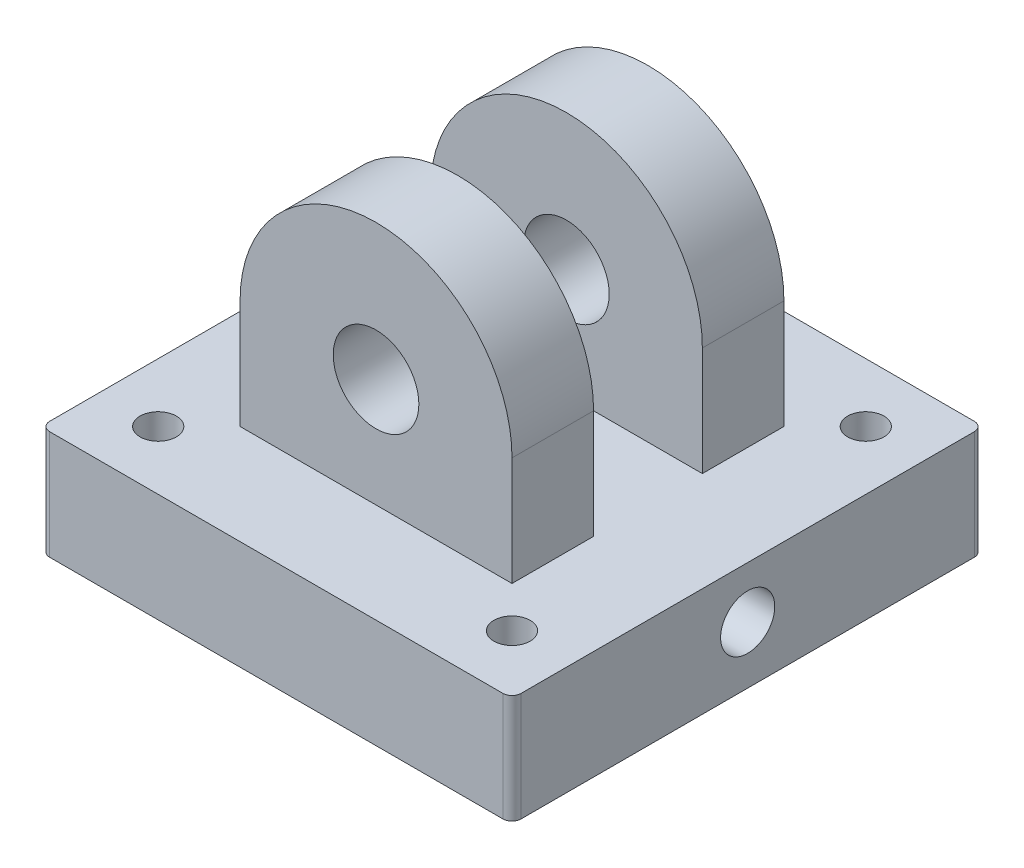
from build123d import *

# Parameters (mm, degrees)
SKETCH1_R                         = 6.35
BOSS_EXTRUDE1_DEPTH               = 38.1
BOSS_EXTRUDE2_START               = -34.925
SKETCH2_R                         = 15
BOSS_EXTRUDE2_DEPTH               = 28.575
SKETCH3_R                         = 26
CUT_EXTRUDE1_DEPTH                = 36.83
SKETCH4_R                         = 76.2
SKETCH4_R_2                       = 69.85
CUT_EXTRUDE2_DEPTH                = 8
F_1_2_14_NPSM_TAPPED_HOLE1_REACH  = 224.273
F_1_2_14_NPSM_TAPPED_HOLE1_BORE_R = 9.4869


with BuildPart() as part:
    # Sketch1 → Boss-Extrude1 (new body)
    with BuildSketch(Plane(origin=(0, 0, 0), x_dir=(1, 0, 0), z_dir=(0, 1, 0))):
        with BuildLine():
            Line((-79.375, -82.55), (79.375, -82.55))
            ThreePointArc((79.375, -82.55), (81.62006403, -81.62006403), (82.55, -79.375))
            Line((82.55, -79.375), (82.55, 79.375))
            ThreePointArc((82.55, 79.375), (81.62006403, 81.62006403), (79.375, 82.55))
            Line((79.375, 82.55), (-79.375, 82.55))
            ThreePointArc((-79.375, 82.55), (-81.62006403, 81.62006403), (-82.55, 79.375))
            Line((-82.55, 79.375), (-82.55, -79.375))
            ThreePointArc((-82.55, -79.375), (-81.62006403, -81.62006403), (-79.375, -82.55))
        make_face()
        with Locations(Location((61.963767235, 61.963767235, 0), (0, 0, 90))):
            Circle(SKETCH1_R, mode=Mode.SUBTRACT)
        with Locations(Location((61.963767235, -61.963767235, 0), (0, 0, 90))):
            Circle(SKETCH1_R, mode=Mode.SUBTRACT)
        with Locations(Location((-61.963767235, -61.963767235, 0), (0, 0, 90))):
            Circle(SKETCH1_R, mode=Mode.SUBTRACT)
        with Locations(Location((-61.963767235, 61.963767235, 0), (0, 0, 90))):
            Circle(SKETCH1_R, mode=Mode.SUBTRACT)
    extrude(amount=BOSS_EXTRUDE1_DEPTH)

    # Sketch2 → Boss-Extrude2 (add)
    with BuildSketch(Plane.XY.offset(82.55).offset(BOSS_EXTRUDE2_START)):
        with BuildLine():
            Line((-47.625, 38.1), (-47.625, 76.2))
            ThreePointArc((-47.625, 76.2), (0, 123.825), (47.625, 76.2))
            Line((47.625, 76.2), (47.625, 38.1))
            Line((47.625, 38.1), (-47.625, 38.1))
        make_face()
        with Locations((0, 76.2)):
            Circle(SKETCH2_R, mode=Mode.SUBTRACT)
    boss_extrude2 = extrude(amount=-BOSS_EXTRUDE2_DEPTH)

    # Mirror1: Boss-Extrude2 across plane
    add(boss_extrude2.mirror(Plane.XY))

    # Sketch3 → Cut-Extrude1 (cut)
    with BuildSketch(Plane.XZ):
        with Locations(Location((0, 0, 0), (0, 0, 270))):
            Circle(SKETCH3_R)
    extrude(amount=-CUT_EXTRUDE1_DEPTH, mode=Mode.SUBTRACT)

    # Sketch4 → Cut-Extrude2 (cut)
    with BuildSketch(Plane.XZ):
        with Locations(Location((0, 0, 0), (0, 0, 270))):
            Circle(SKETCH4_R)
        with Locations(Location((0, 0, 0), (0, 0, 270))):
            Circle(SKETCH4_R_2, mode=Mode.SUBTRACT)
    extrude(amount=-CUT_EXTRUDE2_DEPTH, mode=Mode.SUBTRACT)

    # 1/2-14 NPSM Tapped Hole1 bore → 1/2-14 NPSM Tapped Hole1 (cut, up to next)
    with BuildSketch(Plane(origin=(82.55, 0, 0), x_dir=(0, 0, -1), z_dir=(1, 0, 0)), mode=Mode.PRIVATE) as f_1_2_14_npsm_tapped_hole1_sk1:
        with Locations((0, 20.05)):
            Circle(F_1_2_14_NPSM_TAPPED_HOLE1_BORE_R)
    f_1_2_14_npsm_tapped_hole1_tool1 = extrude(f_1_2_14_npsm_tapped_hole1_sk1.sketch, amount=-F_1_2_14_NPSM_TAPPED_HOLE1_REACH, mode=Mode.PRIVATE) & part.part
    add(f_1_2_14_npsm_tapped_hole1_tool1.solids().sort_by_distance((82.55, 20.05, 0))[0], mode=Mode.SUBTRACT)


solid = part.part
